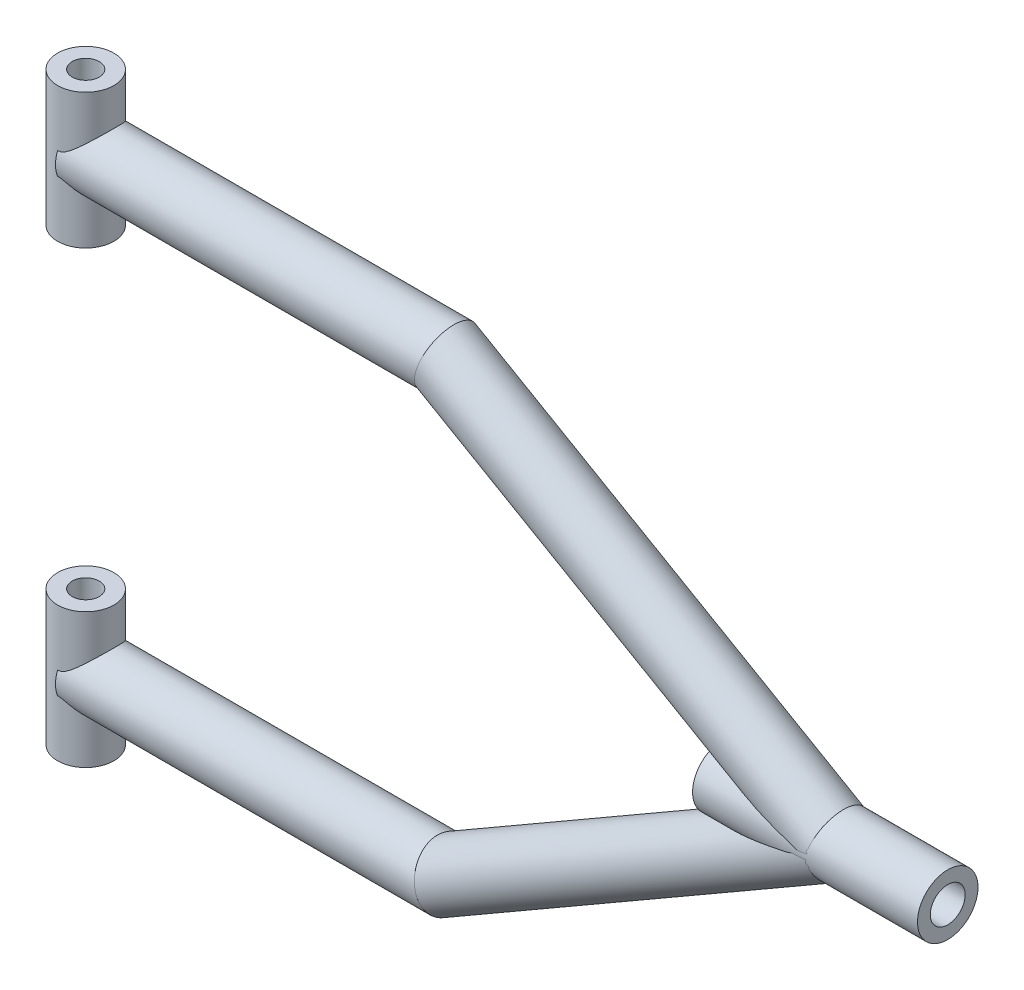
from build123d import *

# Parameters (mm, degrees)
SKETCH11_ON_SEGMENT_1_R        = 13.45
SKETCH11_ON_SEGMENT_1_R_2      = 10.45
PIPE_26_9_X_3_2_1_DEPTH        = 166.096707787
SKETCH11_ON_SEGMENT_2_R        = 13.45
SKETCH11_ON_SEGMENT_2_R_2      = 10.45
PIPE_26_9_X_3_2_1_2_DEPTH      = 240.042344828
SKETCH11_ON_SEGMENT_3_R        = 13.45
SKETCH11_ON_SEGMENT_3_R_2      = 10.45
PIPE_26_9_X_3_2_1_3_DEPTH      = 240.042344828
PIPE_26_9_X_3_2_1_4_DEPTH      = 160
PIPE_26_9_X_3_2_1_4_DEPTH_BACK = 6.096707787
SKETCH11_R                     = 13.45
SKETCH11_R_2                   = 10.45
SKETCH13_R                     = 12.5
SKETCH13_R_2                   = 6
BOSS_EXTRUDE1_DEPTH            = 30
SKETCH14_R                     = 12.5
SKETCH14_R_2                   = 6
BOSS_EXTRUDE2_DEPTH            = 30
SKETCH15_R                     = 13.45
SKETCH15_R_2                   = 7.75
BOSS_EXTRUDE3_DEPTH            = 50
CUT_EXTRUDE1_DEPTH             = 464.278573234
CUT_EXTRUDE1_DEPTH_BACK        = 464.278573234
SKETCH18_R                     = 6
CUT_EXTRUDE3_DEPTH             = 417.729424734
CUT_EXTRUDE3_DEPTH_BACK        = 417.729424734
SKETCH20_R                     = 7.75


with BuildPart() as part:
    # Sketch11 on segment 1 (carried to segment 1) → Pipe 26.9 X 3.2(1) (new body)
    with BuildSketch(Plane(origin=(0, 100, 0), x_dir=(0, 1, 0), z_dir=(1, 0, 0))):
        Circle(SKETCH11_ON_SEGMENT_1_R)
        Circle(SKETCH11_ON_SEGMENT_1_R_2, mode=Mode.SUBTRACT)
    extrude(amount=PIPE_26_9_X_3_2_1_DEPTH)

    # Pipe 26.9 X 3.2(1) mitre 1
    split(bisect_by=Plane(origin=(160, 100, 0), x_dir=(-0.258819045, -0.965925826, 0), z_dir=(-0.965925826, 0.258819045, 0)), keep=Keep.TOP)


with BuildPart() as body_2:
    # Sketch11 on segment 2 (carried to segment 2) → Pipe 26.9 X 3.2_1 2 (new body)
    with BuildSketch(Plane(origin=(154.720096177, 103.048353894, 0), x_dir=(0.5, 0.866025404, 0), z_dir=(0.866025404, -0.5, 0))):
        Circle(SKETCH11_ON_SEGMENT_2_R)
        Circle(SKETCH11_ON_SEGMENT_2_R_2, mode=Mode.SUBTRACT)
    extrude(amount=PIPE_26_9_X_3_2_1_2_DEPTH)

    # Pipe 26.9 X 3.2_1 2 mitre 1
    split(bisect_by=Plane(origin=(160, 100, 0), x_dir=(0.258819045, 0.965925826, 0), z_dir=(0.965925826, -0.258819045, 0)), keep=Keep.TOP)

    # Pipe 26.9 X 3.2_1 2 mitre 2
    split(bisect_by=Plane(origin=(333.205080757, 0, 0), x_dir=(-1, 0, 0), z_dir=(0, 1, 0)), keep=Keep.TOP)


with BuildPart() as body_3:
    # Sketch11 on segment 3 (carried to segment 3) → Pipe 26.9 X 3.2_1 3 (new body)
    with BuildSketch(Plane(origin=(362.602864782, 16.97281852, 0), x_dir=(0.5, -0.866025404, 0), z_dir=(-0.866025404, -0.5, 0))):
        Circle(SKETCH11_ON_SEGMENT_3_R)
        Circle(SKETCH11_ON_SEGMENT_3_R_2, mode=Mode.SUBTRACT)
    extrude(amount=PIPE_26_9_X_3_2_1_3_DEPTH)

    # Pipe 26.9 X 3.2_1 3 mitre 1
    split(bisect_by=Plane(origin=(333.205080757, 0, 0), x_dir=(1, 0, 0), z_dir=(0, -1, 0)), keep=Keep.TOP)

    # Pipe 26.9 X 3.2_1 3 mitre 2
    split(bisect_by=Plane(origin=(160, -100, 0), x_dir=(-0.258819045, 0.965925826, 0), z_dir=(0.965925826, 0.258819045, 0)), keep=Keep.TOP)


with BuildPart() as body_4:
    # Sketch11 → Pipe 26.9 X 3.2_1 4 (new, two sides: drawn at the far end of the back side and taken through both)
    with BuildSketch(Plane(origin=(160, -100, 0), x_dir=(0, -1, 0), z_dir=(-1, 0, 0)).offset(-PIPE_26_9_X_3_2_1_4_DEPTH_BACK)):
        Circle(SKETCH11_R)
        Circle(SKETCH11_R_2, mode=Mode.SUBTRACT)
    extrude(amount=PIPE_26_9_X_3_2_1_4_DEPTH + PIPE_26_9_X_3_2_1_4_DEPTH_BACK)

    # Pipe 26.9 X 3.2_1 4 mitre 1
    split(bisect_by=Plane(origin=(160, -100, 0), x_dir=(0.258819045, -0.965925826, 0), z_dir=(-0.965925826, -0.258819045, 0)), keep=Keep.TOP)


with BuildPart() as body_5:
    # Sketch13 → Boss-Extrude1 (new, symmetric)
    with BuildSketch(Plane(origin=(0, -100, 0), x_dir=(1, 0, 0), z_dir=(0, 1, 0))):
        with Locations(Location((0, 0, 0), (0, 0, 270))):
            Circle(SKETCH13_R)
        with Locations(Location((0, 0, 0), (0, 0, 270))):
            Circle(SKETCH13_R_2, mode=Mode.SUBTRACT)
    extrude(amount=BOSS_EXTRUDE1_DEPTH, both=True)


with BuildPart() as body_6:
    # Sketch14 → Boss-Extrude2 (new, symmetric)
    with BuildSketch(Plane(origin=(0, 100, 0), x_dir=(1, 0, 0), z_dir=(0, 1, 0))):
        with Locations(Location((0, 0, 0), (0, 0, 270))):
            Circle(SKETCH14_R)
        with Locations(Location((0, 0, 0), (0, 0, 270))):
            Circle(SKETCH14_R_2, mode=Mode.SUBTRACT)
    extrude(amount=BOSS_EXTRUDE2_DEPTH, both=True)


with BuildPart() as body_7:
    # Sketch15 → Boss-Extrude3 (new, symmetric)
    with BuildSketch(Plane(origin=(333.205080757, 0, 0), x_dir=(0, 0, -1), z_dir=(1, 0, 0))):
        Circle(SKETCH15_R)
        Circle(SKETCH15_R_2, mode=Mode.SUBTRACT)
    extrude(amount=BOSS_EXTRUDE3_DEPTH, both=True)


with BuildPart() as cut_extrude1_tool:
    # Sketch18 → Cut-Extrude1 (new, two sides: drawn at the far end of the back side and taken through both)
    with BuildSketch(Plane.XZ.offset(130).offset(-CUT_EXTRUDE1_DEPTH_BACK)):
        with Locations(Location((0, 0, 0), (0, 0, 90))):
            Circle(SKETCH18_R)
    extrude(amount=CUT_EXTRUDE1_DEPTH + CUT_EXTRUDE1_DEPTH_BACK)


with BuildPart() as part_1:
    add(part.part)

    # Cut-Extrude1: cut by cut_extrude1_tool
    add(cut_extrude1_tool.part, mode=Mode.SUBTRACT)


with BuildPart() as body_4_1:
    add(body_4.part)

    # Cut-Extrude1: cut by cut_extrude1_tool
    add(cut_extrude1_tool.part, mode=Mode.SUBTRACT)


with BuildPart() as cut_extrude3_tool:
    # Sketch20 → Cut-Extrude3 (new, two sides: drawn at the far end of the back side and taken through both)
    with BuildSketch(Plane(origin=(383.205080757, 0, 0), x_dir=(0, 0, -1), z_dir=(1, 0, 0)).offset(-CUT_EXTRUDE3_DEPTH_BACK)):
        Circle(SKETCH20_R)
    extrude(amount=CUT_EXTRUDE3_DEPTH + CUT_EXTRUDE3_DEPTH_BACK)


with BuildPart() as body_2_1:
    add(body_2.part)

    # Cut-Extrude3: cut by cut_extrude3_tool
    add(cut_extrude3_tool.part, mode=Mode.SUBTRACT)


with BuildPart() as body_3_1:
    add(body_3.part)

    # Cut-Extrude3: cut by cut_extrude3_tool
    add(cut_extrude3_tool.part, mode=Mode.SUBTRACT)


solid = Compound([body_5.part, body_6.part, body_7.part, part_1.part, body_4_1.part, body_2_1.part, body_3_1.part])
